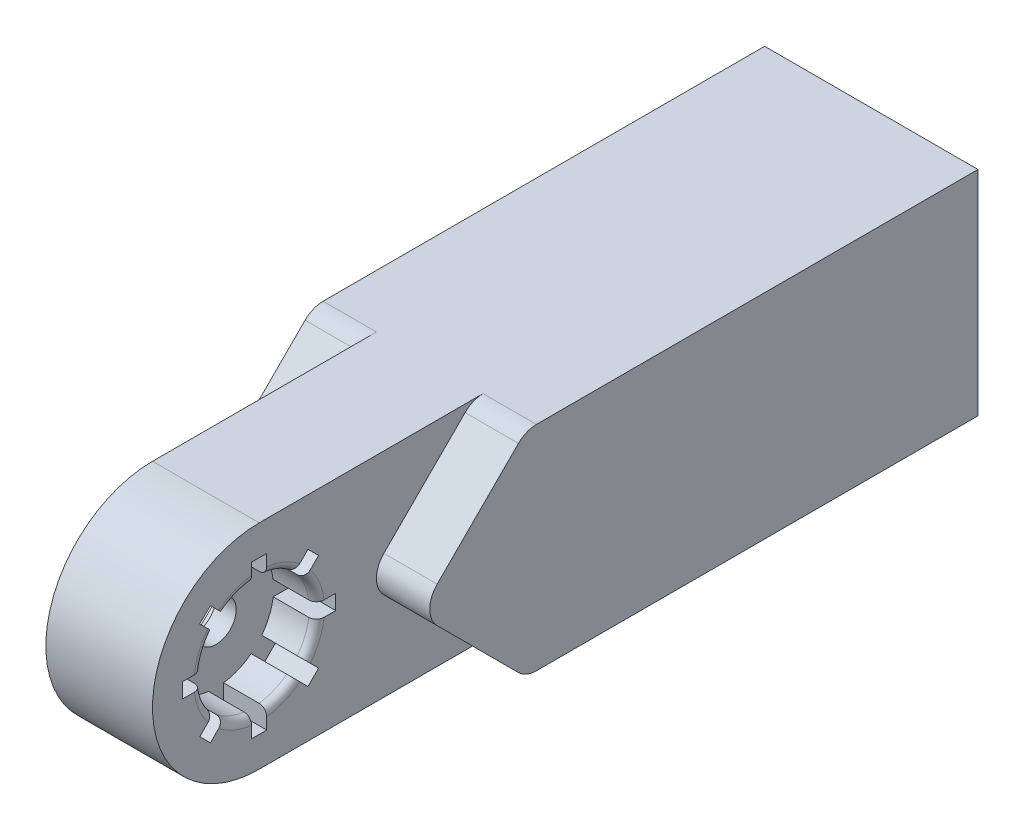
from build123d import *

# Parameters (mm, degrees)
SKETCH2_W                = 42
SKETCH2_H                = 42
BOSS_EXTRUDE1_DEPTH      = 89
SKETCH7_W                = 32
SKETCH7_H                = 32
CUT_EXTRUDE1_DEPTH       = 81
SKETCH3_W                = 21
SKETCH3_H                = 42
BOSS_EXTRUDE2_DEPTH      = 42
BOSS_EXTRUDE3_DEPTH      = 21
SKETCH9_R                = 11.35
CUT_EXTRUDE2_DEPTH       = 8.5
CUT_EXTRUDE3_START       = -8.5
SKETCH11_R               = 11.35
CUT_EXTRUDE3_DEPTH       = 8.5
SKETCH12_R               = 3.975
CUT_EXTRUDE4_DEPTH       = 156.157984003
BOSS_EXTRUDE4_DEPTH      = 10.5
BOSS_EXTRUDE4_DEPTH_BACK = 31.5
FILLET1_R                = 5
FILLET2_R                = 5
FILLET3_R                = 5
FILLET4_R                = 5
FILLET5_R                = 5
FILLET6_R                = 5
FILLET7_R                = 1.5
FILLET8_R                = 1.5
SKETCH21_W               = 2.95860585
SKETCH21_H               = 4.417
CUT_EXTRUDE5_DEPTH       = 8.5
CIRPATTERN2_COUNT        = 8
MIRROR1_COPY_1_SKETCH_W  = 2.95860585
MIRROR1_COPY_1_SKETCH_H  = 4.417
MIRROR1_COPY_1_DEPTH     = 8.5
MIRROR1_COPY_2_SKETCH_W  = 2.95860585
MIRROR1_COPY_2_SKETCH_H  = 4.417
MIRROR1_COPY_2_DEPTH     = 8.5
MIRROR1_COPY_3_SKETCH_W  = 2.95860585
MIRROR1_COPY_3_SKETCH_H  = 4.417
MIRROR1_COPY_3_DEPTH     = 8.5
MIRROR1_COPY_4_SKETCH_W  = 2.95860585
MIRROR1_COPY_4_SKETCH_H  = 4.417
MIRROR1_COPY_4_DEPTH     = 8.5
MIRROR1_COPY_5_SKETCH_W  = 2.95860585
MIRROR1_COPY_5_SKETCH_H  = 4.417
MIRROR1_COPY_5_DEPTH     = 8.5
MIRROR1_COPY_6_SKETCH_W  = 2.95860585
MIRROR1_COPY_6_SKETCH_H  = 4.417
MIRROR1_COPY_6_DEPTH     = 8.5
MIRROR1_COPY_7_SKETCH_W  = 2.95860585
MIRROR1_COPY_7_SKETCH_H  = 4.417
MIRROR1_COPY_7_DEPTH     = 8.5


with BuildPart() as part:
    # Sketch2 → Boss-Extrude1 (new body)
    with BuildSketch(Plane.XY):
        Rectangle(SKETCH2_W, SKETCH2_H)
    extrude(amount=BOSS_EXTRUDE1_DEPTH)

    # Sketch7 → Cut-Extrude1 (cut)
    with BuildSketch(Plane(origin=(0, 0, 0), x_dir=(-1, 0, 0), z_dir=(0, 0, -1))):
        Rectangle(SKETCH7_W, SKETCH7_H)
    extrude(amount=-CUT_EXTRUDE1_DEPTH, mode=Mode.SUBTRACT)

    # Sketch3 → Boss-Extrude2 (add)
    with BuildSketch(Plane.XY.offset(89)):
        Rectangle(SKETCH3_W, SKETCH3_H)
    extrude(amount=BOSS_EXTRUDE2_DEPTH)

    # Sketch8 → Boss-Extrude3 (add)
    with BuildSketch(Plane.ZY.offset(10.5)):
        with BuildLine():
            Line((131, 21), (131, -21))
            ThreePointArc((131, -21), (152, 0), (131, 21))
        make_face()
    extrude(amount=-BOSS_EXTRUDE3_DEPTH)

    # Sketch9 → Cut-Extrude2 (cut)
    with BuildSketch(Plane.ZY.offset(10.5)):
        with Locations((131, 0)):
            Circle(SKETCH9_R)
    extrude(amount=-CUT_EXTRUDE2_DEPTH, mode=Mode.SUBTRACT)

    # Sketch11 → Cut-Extrude3 (cut)
    with BuildSketch(Plane(origin=(10.5, 0, 0), x_dir=(0, 0, -1), z_dir=(1, 0, 0)).offset(CUT_EXTRUDE3_START)):
        with Locations(Location((-131, 0, 0), (0, 0, 180))):
            Circle(SKETCH11_R)
    extrude(amount=CUT_EXTRUDE3_DEPTH, mode=Mode.SUBTRACT)

    # Sketch12 → Cut-Extrude4 (cut, through all)
    with BuildSketch(Plane.ZY.offset(2)):
        with Locations((131, 0)):
            Circle(SKETCH12_R)
    extrude(amount=-CUT_EXTRUDE4_DEPTH, mode=Mode.SUBTRACT)

    # Sketch20 → Boss-Extrude4 (add, two sides: drawn at the far end of the back side and taken through both)
    with BuildSketch(Plane.ZY.offset(10.5).offset(-BOSS_EXTRUDE4_DEPTH_BACK)):
        Polygon((89, 21), (110, 0), (89, -21), align=None)
    extrude(amount=BOSS_EXTRUDE4_DEPTH + BOSS_EXTRUDE4_DEPTH_BACK)

    # Fillet1
    fillet1_edges = [part.edges().sort_by_distance(p)[0] for p in [
        (15.75, 0, 110),
    ]]
    fillet(fillet1_edges, radius=FILLET1_R)

    # Fillet2
    fillet2_edges = [part.edges().sort_by_distance(p)[0] for p in [
        (-15.75, 0, 110),
    ]]
    fillet(fillet2_edges, radius=FILLET2_R)

    # Fillet3
    fillet3_edges = [part.edges().sort_by_distance(p)[0] for p in [
        (-15.75, -21, 89),
    ]]
    fillet(fillet3_edges, radius=FILLET3_R)

    # Fillet4
    fillet4_edges = [part.edges().sort_by_distance(p)[0] for p in [
        (-15.75, 21, 89),
    ]]
    fillet(fillet4_edges, radius=FILLET4_R)

    # Fillet5
    fillet5_edges = [part.edges().sort_by_distance(p)[0] for p in [
        (15.75, -21, 89),
    ]]
    fillet(fillet5_edges, radius=FILLET5_R)

    # Fillet6
    fillet6_edges = [part.edges().sort_by_distance(p)[0] for p in [
        (15.75, 21, 89),
    ]]
    fillet(fillet6_edges, radius=FILLET6_R)

    # Fillet7
    fillet7_edges = [part.edges().sort_by_distance(p)[0] for p in [
        (-10.5, 0, 119.65),
    ]]
    fillet(fillet7_edges, radius=FILLET7_R)

    # Fillet8
    fillet8_edges = [part.edges().sort_by_distance(p)[0] for p in [
        (10.5, 0, 119.65),
    ]]
    fillet(fillet8_edges, radius=FILLET8_R)

    # Sketch21 → Cut-Extrude5 (cut)
    with BuildSketch(Plane.ZY.offset(10.5)):
        with Locations((131, 12.85)):
            Rectangle(SKETCH21_W, SKETCH21_H)
    cut_extrude5 = extrude(amount=-CUT_EXTRUDE5_DEPTH, mode=Mode.SUBTRACT)

    # CirPattern2: Cut-Extrude5 ×8 about axis
    cirpattern2_axis = Axis((0, 0, 131), (1, 0, 0))
    for i in range(1, CIRPATTERN2_COUNT):
        add(cut_extrude5.rotate(cirpattern2_axis, i * 360 / CIRPATTERN2_COUNT), mode=Mode.SUBTRACT)

    # Mirror1: Cut-Extrude5 across plane
    add(cut_extrude5.mirror(Plane(origin=(0, 0, 0), x_dir=(0, 0, 1), z_dir=(1, 0, 0))), mode=Mode.SUBTRACT)

    # Mirror1 copy 1 sketch → Mirror1 copy 1 (cut)
    with BuildSketch(Plane(origin=(10.5, 92.630988335, 38.369011665), x_dir=(0, -0.7071067811865475, 0.7071067811865476), z_dir=(1, 0, 0))):
        with Locations((131, -12.85)):
            Rectangle(MIRROR1_COPY_1_SKETCH_W, MIRROR1_COPY_1_SKETCH_H)
    extrude(amount=-MIRROR1_COPY_1_DEPTH, mode=Mode.SUBTRACT)

    # Mirror1 copy 2 sketch → Mirror1 copy 2 (cut)
    with BuildSketch(Plane(origin=(10.5, 131, 131), x_dir=(0, -1, 0), z_dir=(1, 0, 0))):
        with Locations((131, -12.85)):
            Rectangle(MIRROR1_COPY_2_SKETCH_W, MIRROR1_COPY_2_SKETCH_H)
    extrude(amount=-MIRROR1_COPY_2_DEPTH, mode=Mode.SUBTRACT)

    # Mirror1 copy 3 sketch → Mirror1 copy 3 (cut)
    with BuildSketch(Plane(origin=(10.5, 92.630988335, 223.630988335), x_dir=(0, -0.7071067811865476, -0.7071067811865475), z_dir=(1, 0, 0))):
        with Locations((131, -12.85)):
            Rectangle(MIRROR1_COPY_3_SKETCH_W, MIRROR1_COPY_3_SKETCH_H)
    extrude(amount=-MIRROR1_COPY_3_DEPTH, mode=Mode.SUBTRACT)

    # Mirror1 copy 4 sketch → Mirror1 copy 4 (cut)
    with BuildSketch(Plane(origin=(10.5, 0, 262), x_dir=(0, 0, -1), z_dir=(1, 0, 0))):
        with Locations((131, -12.85)):
            Rectangle(MIRROR1_COPY_4_SKETCH_W, MIRROR1_COPY_4_SKETCH_H)
    extrude(amount=-MIRROR1_COPY_4_DEPTH, mode=Mode.SUBTRACT)

    # Mirror1 copy 5 sketch → Mirror1 copy 5 (cut)
    with BuildSketch(Plane(origin=(10.5, -92.630988335, 223.630988335), x_dir=(0, 0.7071067811865475, -0.7071067811865477), z_dir=(1, 0, 0))):
        with Locations((131, -12.85)):
            Rectangle(MIRROR1_COPY_5_SKETCH_W, MIRROR1_COPY_5_SKETCH_H)
    extrude(amount=-MIRROR1_COPY_5_DEPTH, mode=Mode.SUBTRACT)

    # Mirror1 copy 6 sketch → Mirror1 copy 6 (cut)
    with BuildSketch(Plane(origin=(10.5, -131, 131), x_dir=(0, 1, 0), z_dir=(1, 0, 0))):
        with Locations((131, -12.85)):
            Rectangle(MIRROR1_COPY_6_SKETCH_W, MIRROR1_COPY_6_SKETCH_H)
    extrude(amount=-MIRROR1_COPY_6_DEPTH, mode=Mode.SUBTRACT)

    # Mirror1 copy 7 sketch → Mirror1 copy 7 (cut)
    with BuildSketch(Plane(origin=(10.5, -92.630988335, 38.369011665), x_dir=(0, 0.7071067811865477, 0.7071067811865474), z_dir=(1, 0, 0))):
        with Locations((131, -12.85)):
            Rectangle(MIRROR1_COPY_7_SKETCH_W, MIRROR1_COPY_7_SKETCH_H)
    extrude(amount=-MIRROR1_COPY_7_DEPTH, mode=Mode.SUBTRACT)


solid = part.part
